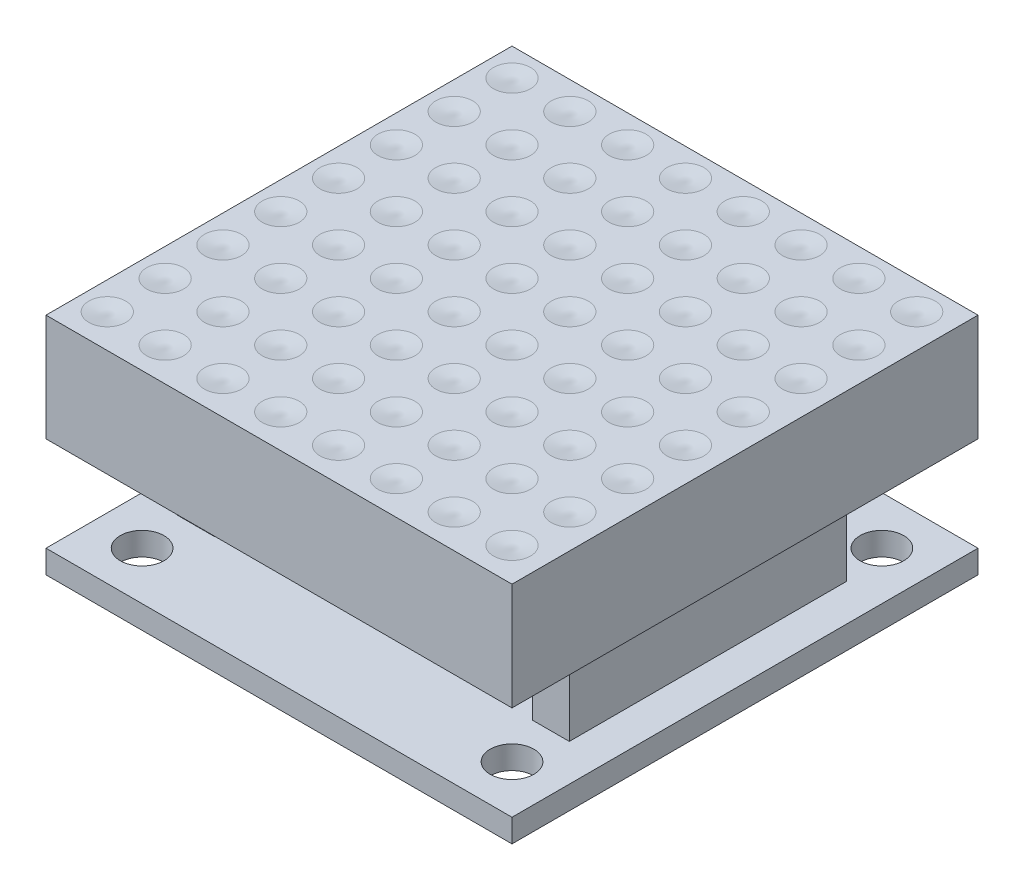
from build123d import *

# Parameters (mm, degrees)
SKETCH1_W            = 32
SKETCH1_H            = 32
BOSS_EXTRUDE1_DEPTH  = 7.36
SKETCH2_W            = 2.54
SKETCH2_H            = 19.05
BOSS_EXTRUDE2_DEPTH  = 6.5
SKETCH3_W            = 32
SKETCH3_H            = 32
BOSS_EXTRUDE3_DEPTH  = 1.5875
SKETCH4_R            = 1.5
CUT_EXTRUDE1_DEPTH   = 1.5875
LPATTERN1_COUNT      = 8
LPATTERN1_PITCH      = 3.97
LPATTERN1_COUNT_DIR2 = 8
LPATTERN1_PITCH_DIR2 = 3.97


with BuildPart() as part:
    # Sketch1 → Boss-Extrude1 (new body)
    with BuildSketch(Plane(origin=(0, 0, 0), x_dir=(1, 0, 0), z_dir=(0, 1, 0))):
        with Locations((16, 16)):
            Rectangle(SKETCH1_W, SKETCH1_H)
    extrude(amount=BOSS_EXTRUDE1_DEPTH)

    # Sketch2 → Boss-Extrude2 (add)
    with BuildSketch(Plane.XZ):
        with Locations((28.19, -16)):
            Rectangle(SKETCH2_W, SKETCH2_H)
        with Locations((3.81, -16)):
            Rectangle(SKETCH2_W, SKETCH2_H)
    extrude(amount=BOSS_EXTRUDE2_DEPTH)

    # Sketch3 → Boss-Extrude3 (add)
    with BuildSketch(Plane.XZ.offset(6.5)):
        with Locations((16, -16)):
            Rectangle(SKETCH3_W, SKETCH3_H)
    extrude(amount=BOSS_EXTRUDE3_DEPTH)

    # Sketch4 → Cut-Extrude1 (cut)
    with BuildSketch(Plane.XZ.offset(8.0875)):
        with Locations(Location((3.3, -28.7, 0), (0, 0, 270))):
            Circle(SKETCH4_R)
        with Locations(Location((28.7, -28.7, 0), (0, 0, 270))):
            Circle(SKETCH4_R)
        with Locations(Location((28.7, -3.3, 0), (0, 0, 270))):
            Circle(SKETCH4_R)
        with Locations(Location((3.3, -3.3, 0), (0, 0, 270))):
            Circle(SKETCH4_R)
    extrude(amount=-CUT_EXTRUDE1_DEPTH, mode=Mode.SUBTRACT)

    # Cut-Extrude2 cone 1 section (through the dimple's axis) → Cut-Extrude2 (revolve, cut)
    with BuildSketch(Plane(origin=(1.905, 7.36, -30.095), x_dir=(0, 0, 1), z_dir=(1, 0, 0))):
        Polygon((0, 0), (1.27, 0), (0, 0.223935265), align=None)
    cut_extrude2 = revolve(axis=Axis((1.905, 7.36, -30.095), (0, -1, 0)), mode=Mode.SUBTRACT)

    # LPattern1: Cut-Extrude2 8 × 8
    with Locations(*[(i * LPATTERN1_PITCH, 0, j * LPATTERN1_PITCH_DIR2) for i in range(LPATTERN1_COUNT) for j in range(LPATTERN1_COUNT_DIR2) if (i, j) != (0, 0)]):
        add(cut_extrude2, mode=Mode.SUBTRACT)


solid = part.part
